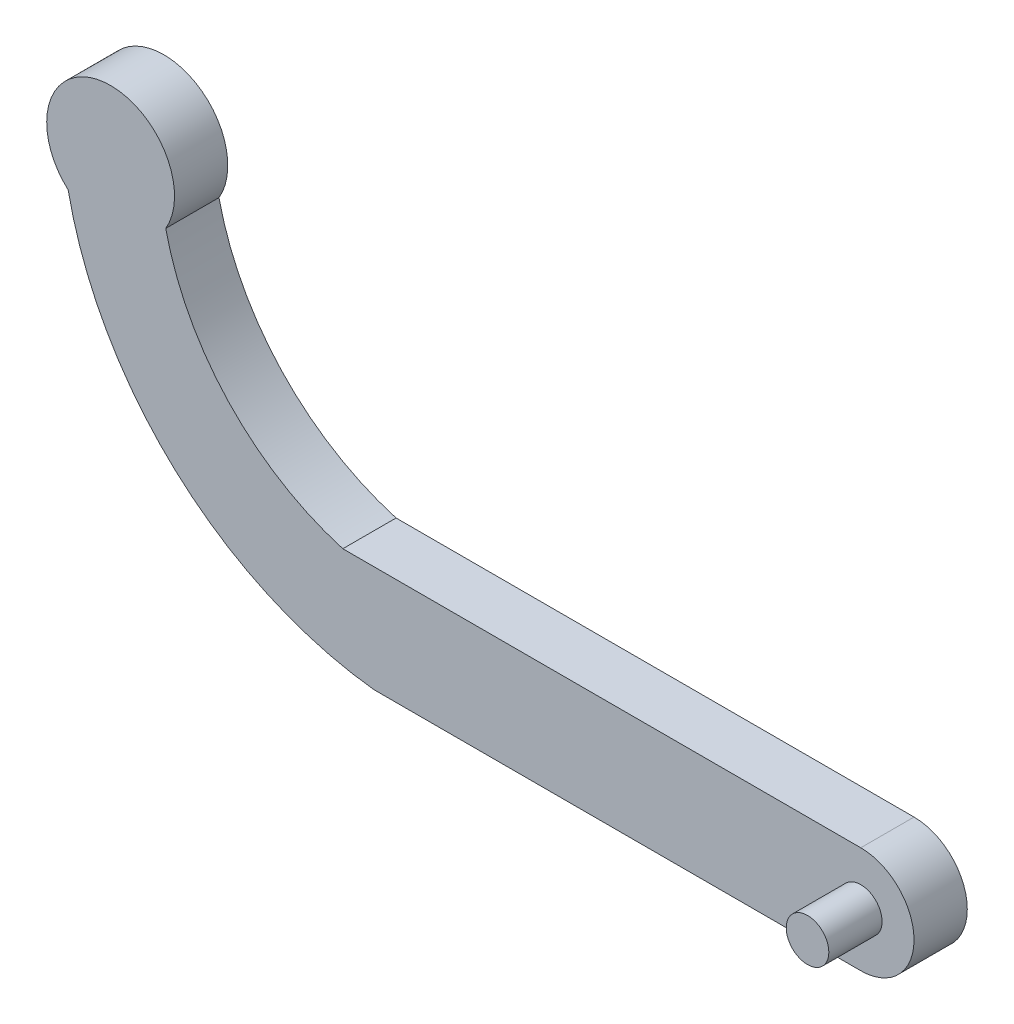
from build123d import *

# Parameters (mm, degrees)
SALIENTE_EXTRUIR1_DEPTH = 5
CROQUIS2_R              = 2
SALIENTE_EXTRUIR2_DEPTH = 5


with BuildPart() as part:
    # Croquis1 → Saliente-Extruir1 (new body)
    with BuildSketch(Plane.XY):
        with BuildLine():
            Line((-25.953664325, 5.804713338), (22.678050908, 5.804713338))
            ThreePointArc((22.678050908, 5.804713338), (27.678050908, 0.804713338), (22.678050908, -4.195286662))
            Line((22.678050908, -4.195286662), (-23.047151147, -4.195286662))
            ThreePointArc((-23.047151147, -4.195286662), (-41.661617991, 4.287687085), (-51.741257509, 22.088251307))
            ThreePointArc((-51.741257509, 22.088251307), (-48.695784379, 32.499543684), (-42.578743977, 23.541210565))
            ThreePointArc((-42.578743977, 23.541210565), (-36.695300038, 12.396079877), (-25.953664325, 5.804713338))
        make_face()
    extrude(amount=SALIENTE_EXTRUIR1_DEPTH)

    # Croquis2 → Saliente-Extruir2 (add)
    with BuildSketch(Plane.XY.offset(5)):
        with Locations((22.678050908, 0.804713338)):
            Circle(CROQUIS2_R)
    extrude(amount=SALIENTE_EXTRUIR2_DEPTH)


solid = part.part
